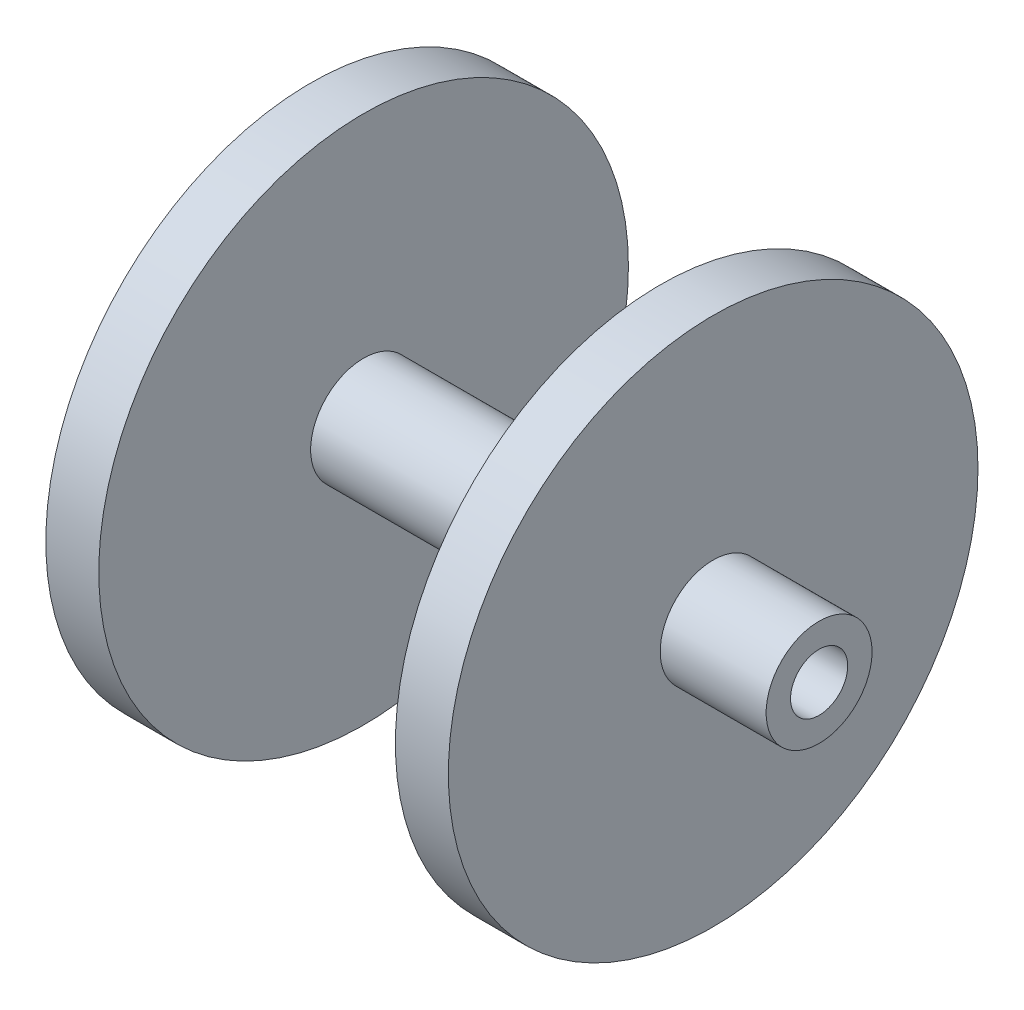
from build123d import *

# Parameters (mm, degrees)
SKETCH4_R          = 3.429
CUT_EXTRUDE1_DEPTH = 5.715


with BuildPart() as part:
    # Sketch2 → Revolve1 (revolve)
    with BuildSketch(Plane.XY, mode=Mode.PRIVATE) as revolve1_sk:
        Polygon((0, 31.75), (6.35, 31.75), (6.35, 6.35), (41.91, 6.35), (41.91, 31.75), (48.26, 31.75), (48.26, 6.35), (60.96, 6.35), (60.96, 0), (48.26, 0), (0, 0), (-12.7, 0), (-12.7, 6.35), (0, 6.35), align=None)
    revolve(revolve1_sk.sketch.rotate(Axis((48.26, 0, 0), (-1, 0, 0)), 90), axis=Axis((48.26, 0, 0), (-1, 0, 0)))

    # Sketch4 → Cut-Extrude1 (cut)
    with BuildSketch(Plane(origin=(60.96, 0, 0), x_dir=(0, 0, -1), z_dir=(1, 0, 0))):
        Circle(SKETCH4_R)
    extrude(amount=-CUT_EXTRUDE1_DEPTH, mode=Mode.SUBTRACT)


solid = part.part
